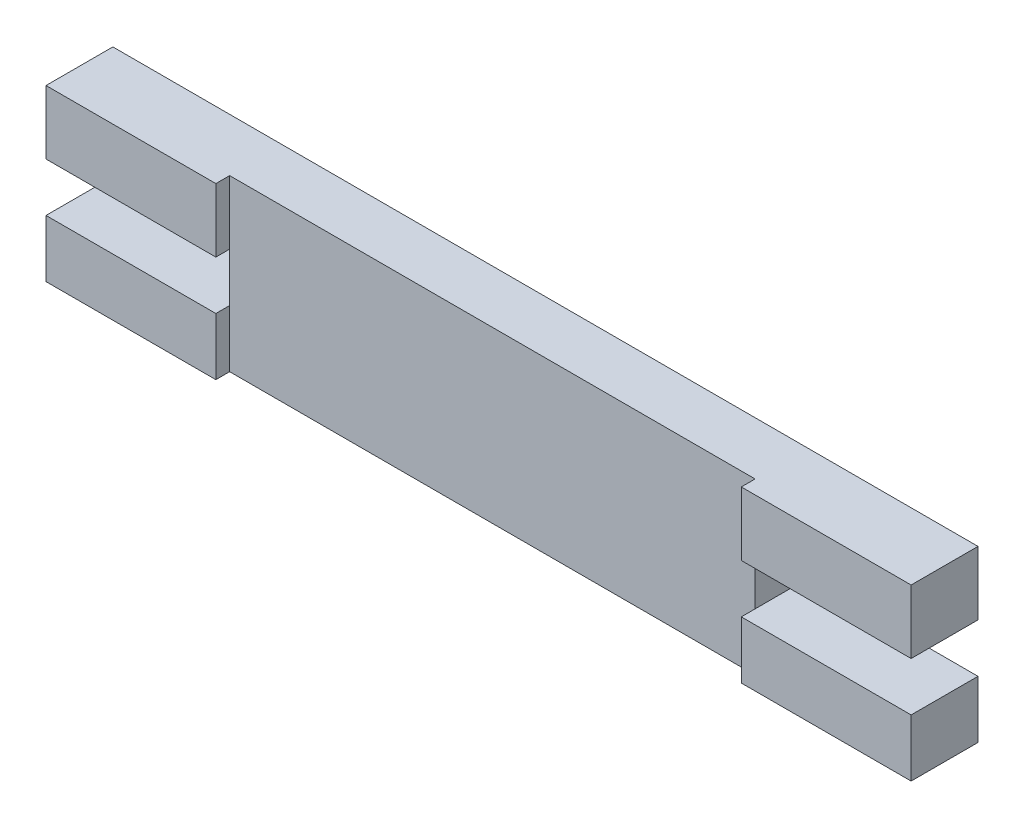
from build123d import *

# Parameters (mm, degrees)
BOSS_EXTRUDE1_DEPTH = 2.5
SKETCH1_3_W         = 3.753393981
SKETCH1_3_H         = 3
SKETCH1_3_W_2       = 4.246606019
SKETCH1_3_H_2       = 2.7
SKETCH1_3_W_3       = 8
BOSS_EXTRUDE2_DEPTH = 3.15


with BuildPart() as part:
    # Sketch1 → Boss-Extrude1 (new body)
    with BuildSketch(Plane.XY):
        Polygon((12.375, 4), (-12.375, 4), (-12.375, 1), (-12.375, -1.3), (-12.375, -4), (12.375, -4), (12.375, -1.3), (12.375, 1), align=None)
    extrude(amount=BOSS_EXTRUDE1_DEPTH)

    # Sketch1<3> → Boss-Extrude2 (add)
    with BuildSketch(Plane.XY):
        with Locations((-18.498303009, 2.5)):
            Rectangle(SKETCH1_3_W, SKETCH1_3_H)
        with Locations((-14.49830301, 2.5)):
            Rectangle(SKETCH1_3_W_2, SKETCH1_3_H)
        with Locations((-14.49830301, -2.65)):
            Rectangle(SKETCH1_3_W_2, SKETCH1_3_H_2)
        with Locations((-18.498303009, -2.65)):
            Rectangle(SKETCH1_3_W, SKETCH1_3_H_2)
        with Locations((16.375, -2.65)):
            Rectangle(SKETCH1_3_W_3, SKETCH1_3_H_2)
        with Locations((16.375, 2.5)):
            Rectangle(SKETCH1_3_W_3, SKETCH1_3_H)
    extrude(amount=BOSS_EXTRUDE2_DEPTH)


solid = part.part
